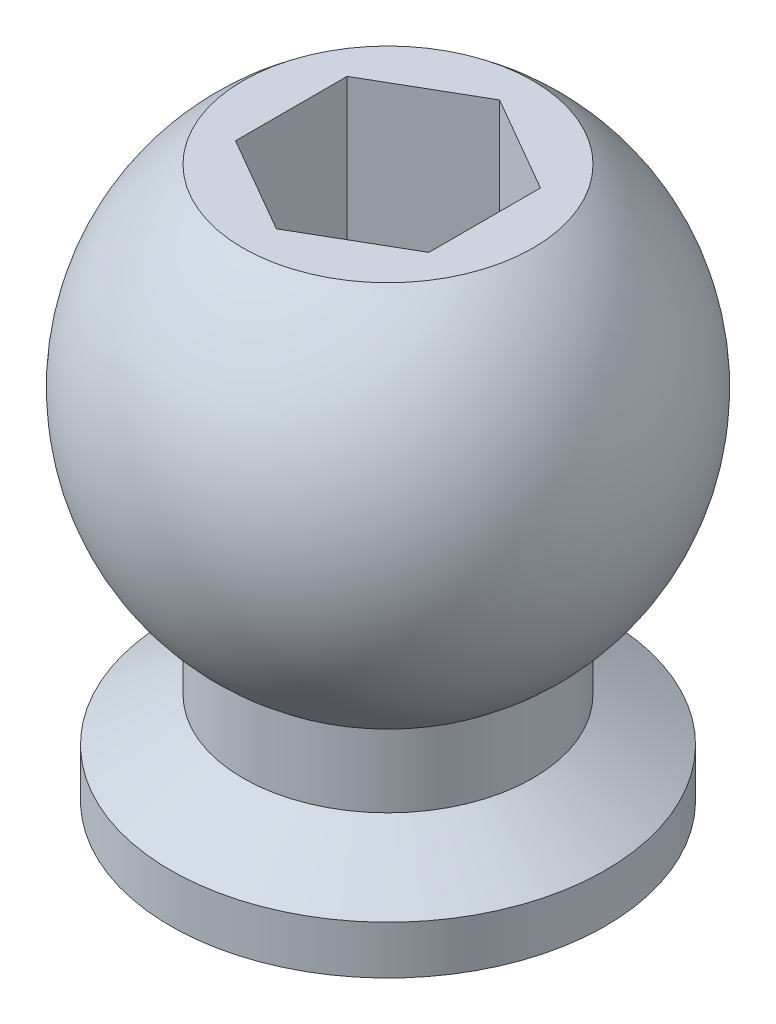
from build123d import *

# Parameters (mm, degrees)
CUT_EXTRUDE1_DEPTH = 2.54
M2_TAPPED_HOLE1_D  = 1.6


with BuildPart() as part:
    # Sketch1 → Revolve1 (revolve)
    with BuildSketch(Plane.XY, mode=Mode.PRIVATE) as revolve1_sk:
        with BuildLine():
            Line((0, 0), (0, 5.7))
            Line((0, 5.7), (-1.5, 5.7))
            ThreePointArc((-1.5, 5.7), (-2.5, 3.7), (-1.5, 1.7))
            Line((-1.5, 1.7), (-1.5, 0.95))
            Line((-1.5, 0.95), (-2.25, 0.5))
            Line((-2.25, 0.5), (-2.25, 0))
            Line((-2.25, 0), (0, 0))
        make_face()
    revolve(revolve1_sk.sketch.rotate(Axis((0, 0, 0), (0, 1, 0)), 270), axis=Axis((0, 0, 0), (0, 1, 0)))

    # Sketch2 → Cut-Extrude1 (cut)
    with BuildSketch(Plane(origin=(0, 5.7, 0), x_dir=(1, 0, 0), z_dir=(0, 1, 0))):
        Polygon((-1, -0.577350269), (-1, 0.577350269), (0, 1.154700538), (1, 0.577350269), (1, -0.577350269), (0, -1.154700538), align=None)
    extrude(amount=-CUT_EXTRUDE1_DEPTH, mode=Mode.SUBTRACT)

    # M2 Tapped Hole1 (through all)
    with Locations(Plane(origin=(0, 0, 0), x_dir=(-1, 0, 0), z_dir=(0, -1, 0))):
        with Locations((0, 0)):
            Hole(M2_TAPPED_HOLE1_D / 2)


solid = part.part
